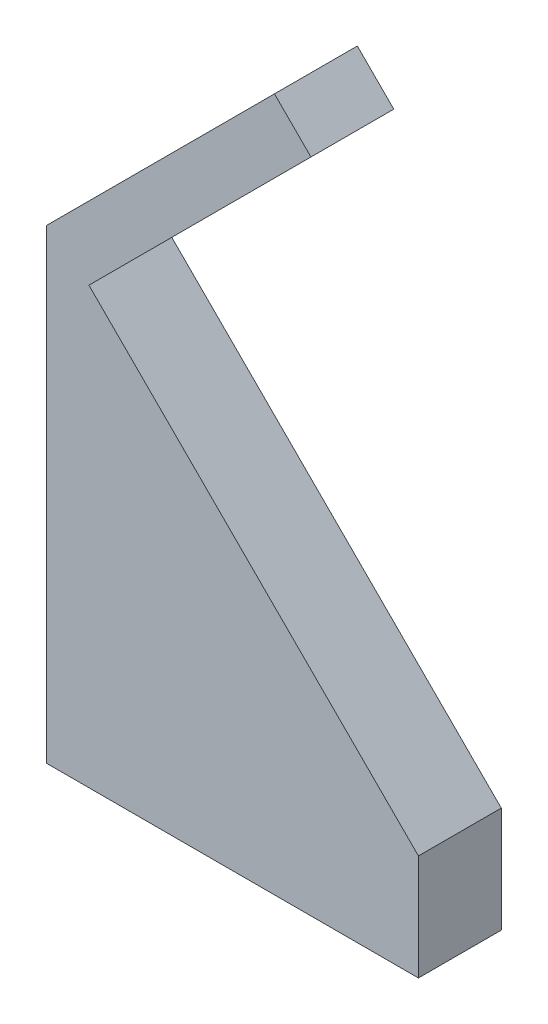
from build123d import *

# Parameters (mm, degrees)
SALIENTE_EXTRUIR1_DEPTH = 8


with BuildPart() as part:
    # Croquis1 → Saliente-Extruir1 (new body)
    with BuildSketch(Plane.XY):
        Polygon((-5, -39.790199458), (-5, -50), (-40.894698343, -50), (-40.894698343, -5.001362042), (-18.901278788, 16.992057514), (-15.379316062, 13.470094787), (-36.819805153, -7.970394304), align=None)
    extrude(amount=SALIENTE_EXTRUIR1_DEPTH)


solid = part.part
